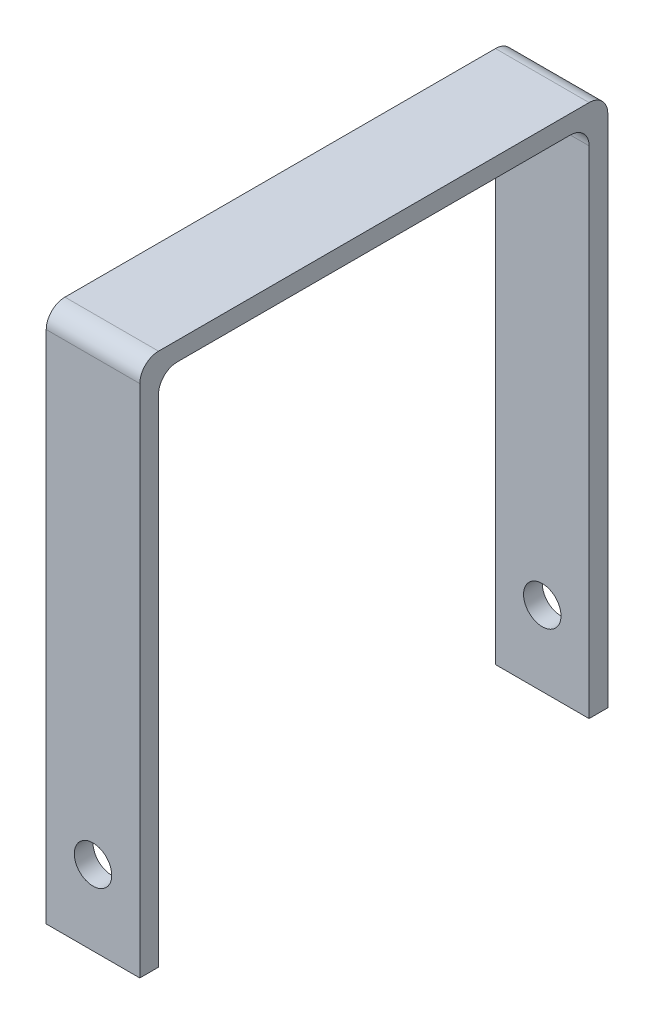
from build123d import *

# Parameters (mm, degrees)
EXTRUDE_1_DEPTH     = 10
SKETCH_2_R          = 2
CUT_EXTRUDE_1_DEPTH = 77.47875522


with BuildPart() as part:
    # 草图1 → 凸台-拉伸1 (new body)
    with BuildSketch(Plane(origin=(0, 0, 0), x_dir=(0, 0, -1), z_dir=(1, 0, 0))):
        with BuildLine():
            Line((0, 0), (0, 55))
            ThreePointArc((0, 55), (0.585786438, 56.414213562), (2, 57))
            Line((2, 57), (48, 57))
            ThreePointArc((48, 57), (49.414213562, 56.414213562), (50, 55))
            Line((50, 55), (50, 0))
            Line((50, 0), (48, 0))
            Line((48, 0), (48, 53))
            ThreePointArc((48, 53), (47.414213562, 54.414213562), (46, 55))
            Line((46, 55), (4, 55))
            ThreePointArc((4, 55), (2.585786438, 54.414213562), (2, 53))
            Line((2, 53), (2, 0))
            Line((2, 0), (0, 0))
        make_face()
    extrude(amount=EXTRUDE_1_DEPTH)

    # 草图2 → 切除-拉伸1 (cut, through all)
    with BuildSketch(Plane.XY):
        with Locations((5, 8)):
            Circle(SKETCH_2_R)
    extrude(amount=-CUT_EXTRUDE_1_DEPTH, mode=Mode.SUBTRACT)


solid = part.part
